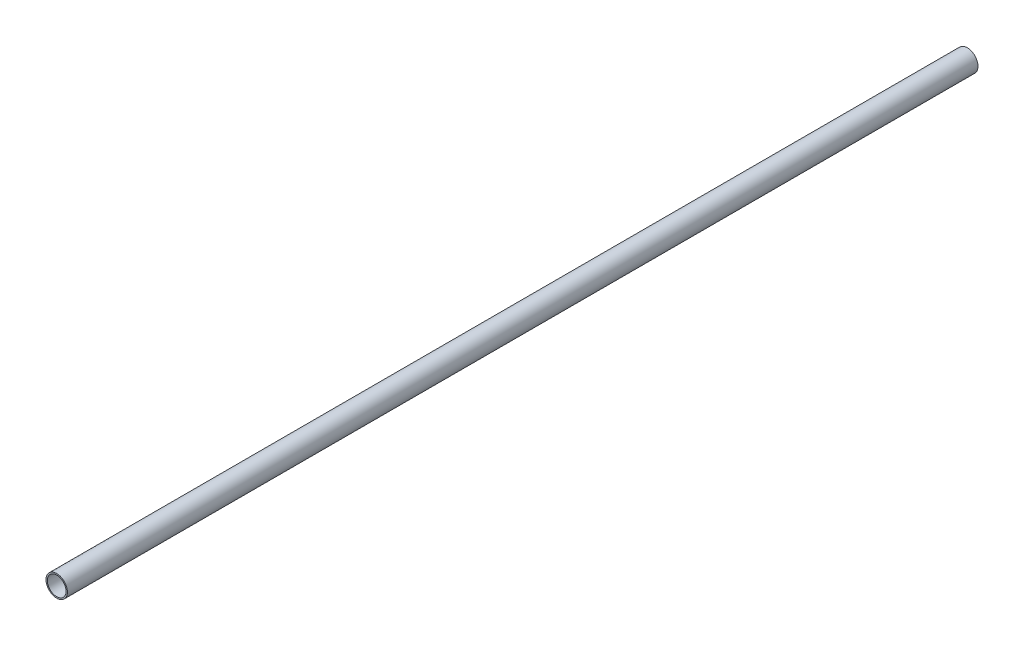
from build123d import *

# Parameters (mm, degrees)
SKETCH_1_R      = 8
SKETCH_1_R_2    = 7
EXTRUDE_1_DEPTH = 340


with BuildPart() as part:
    # Эскиз1 → Бобышка-Вытянуть1 (new, symmetric)
    with BuildSketch(Plane.XY):
        Circle(SKETCH_1_R)
        Circle(SKETCH_1_R_2, mode=Mode.SUBTRACT)
    extrude(amount=EXTRUDE_1_DEPTH, both=True)


solid = part.part
